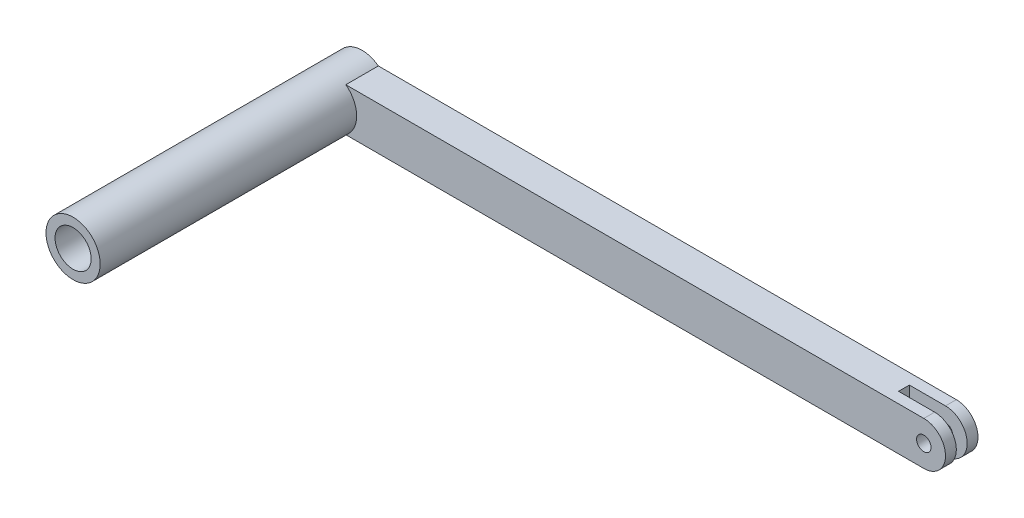
from build123d import *

# Parameters (mm, degrees)
SKETCH_1_R          = 7.5
SKETCH_1_R_2        = 5
EXTRUDE_1_DEPTH     = 80
EXTRUDE_START       = -9
SKETCH_2_R          = 2
EXTRUDE_2_DEPTH     = 9
SKETCH_4_W          = 20
SKETCH_4_H          = 3
CUT_EXTRUDE_1_DEPTH = 20


with BuildPart() as part:
    # 草图1 → 凸台-拉伸1 (new body)
    with BuildSketch(Plane.XY):
        Circle(SKETCH_1_R)
        Circle(SKETCH_1_R_2, mode=Mode.SUBTRACT)
    extrude(amount=EXTRUDE_1_DEPTH)

    # 草图2 → 凸台-拉伸2 (add)
    with BuildSketch(Plane.XY.offset(9).offset(EXTRUDE_START)):
        with BuildLine():
            Line((164.5, -6), (4.5, -6))
            ThreePointArc((4.5, -6), (7.5, 0), (4.5, 6))
            Line((4.5, 6), (164.5, 6))
            ThreePointArc((164.5, 6), (170.5, 0), (164.5, -6))
        make_face()
        with Locations((164.5, 0)):
            Circle(SKETCH_2_R, mode=Mode.SUBTRACT)
    extrude(amount=EXTRUDE_2_DEPTH)

    # 草图4 → 切除-拉伸1 (cut)
    with BuildSketch(Plane(origin=(0, 6, 0), x_dir=(1, 0, 0), z_dir=(0, 1, 0))):
        with Locations((164.5, -4.5)):
            Rectangle(SKETCH_4_W, SKETCH_4_H)
    extrude(amount=-CUT_EXTRUDE_1_DEPTH, mode=Mode.SUBTRACT)


solid = part.part
